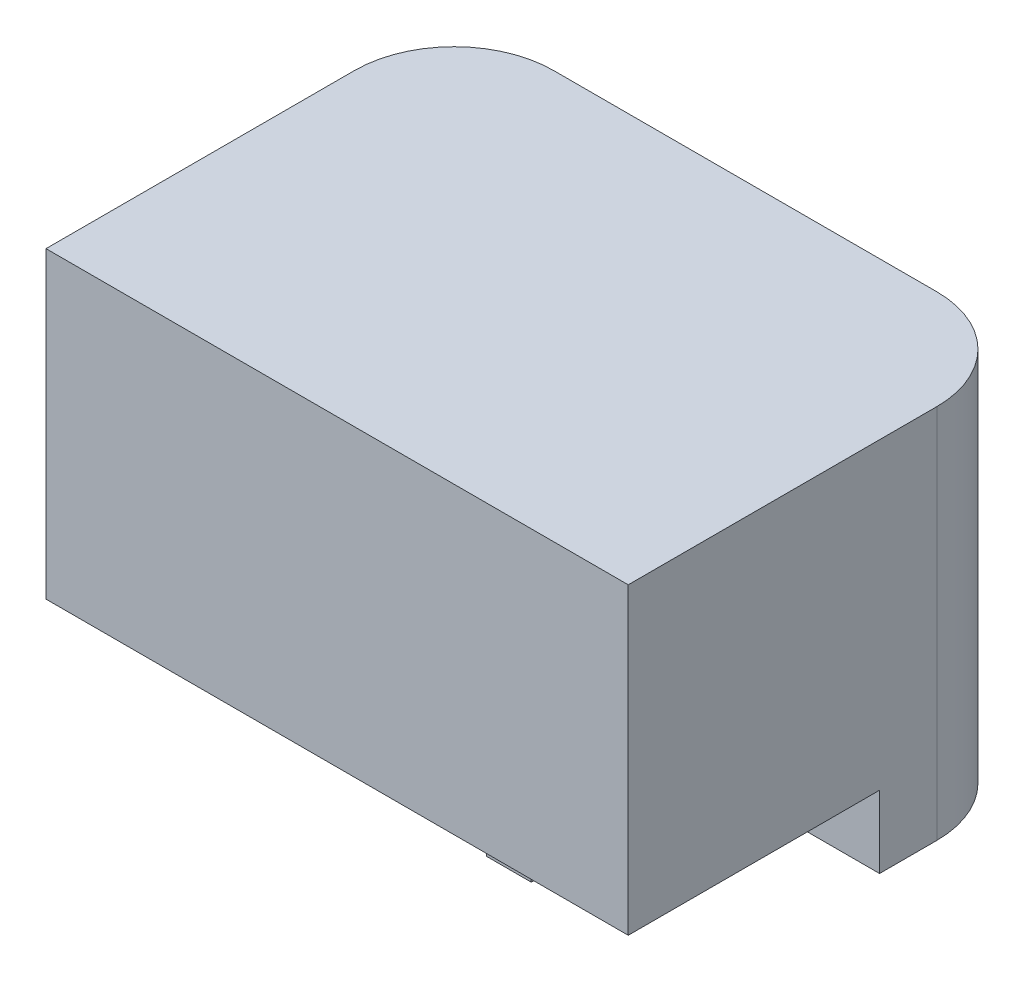
from build123d import *

# Parameters (mm, degrees)
SKETCH1_W           = 234
SKETCH1_H           = 164
BOSS_EXTRUDE1_DEPTH = 151
SKETCH2_W           = 134.536158908
SKETCH2_H           = 46.032358143
CUT_EXTRUDE1_DEPTH  = 291.311901237
FILLET1_R           = 40
SKETCH3_W           = 18
SKETCH3_H           = 30
BOSS_EXTRUDE2_DEPTH = 70
SKETCH4_R           = 3
CUT_EXTRUDE2_DEPTH  = 214.07510413


with BuildPart() as part:
    # Sketch1 → Boss-Extrude1 (new body)
    with BuildSketch(Plane(origin=(0, 0, 0), x_dir=(1, 0, 0), z_dir=(0, 1, 0))):
        Rectangle(SKETCH1_W, SKETCH1_H)
    extrude(amount=BOSS_EXTRUDE1_DEPTH)

    # Sketch2 → Cut-Extrude1 (cut, through all)
    with BuildSketch(Plane.ZY.offset(117)):
        with Locations((48.268079454, 5.983820929)):
            Rectangle(SKETCH2_W, SKETCH2_H)
    extrude(amount=-CUT_EXTRUDE1_DEPTH, mode=Mode.SUBTRACT)

    # Fillet1
    fillet1_edges = [part.edges().sort_by_distance(p)[0] for p in [
        (-117, 75.5, -82),
        (117, 75.5, -82),
    ]]
    fillet(fillet1_edges, radius=FILLET1_R)

    # Sketch3 → Boss-Extrude2 (add)
    with BuildSketch(Plane.XZ.offset(-29)):
        with Locations((0, -2)):
            Rectangle(SKETCH3_W, SKETCH3_H)
    extrude(amount=BOSS_EXTRUDE2_DEPTH)

    # Sketch4 → Cut-Extrude2 (cut, through all)
    with BuildSketch(Plane.ZY.offset(9)):
        with Locations((0, -31)):
            Circle(SKETCH4_R)
    extrude(amount=-CUT_EXTRUDE2_DEPTH, mode=Mode.SUBTRACT)


solid = part.part
